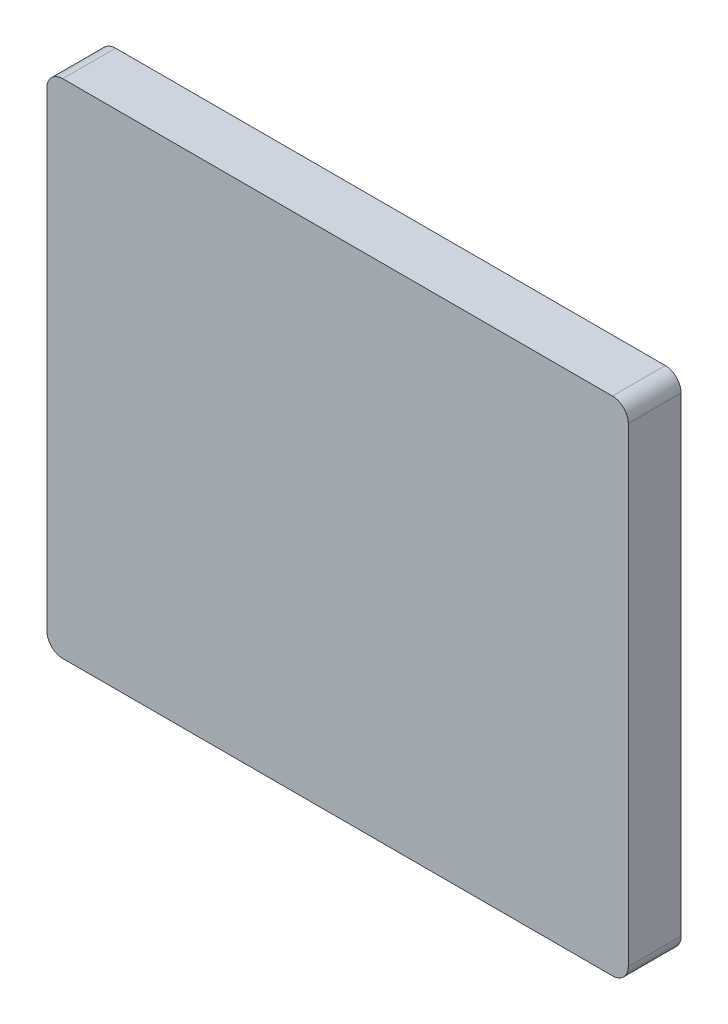
from build123d import *

# Parameters (mm, degrees)
SKETCH1_W           = 110
SKETCH1_H           = 95
BOSS_EXTRUDE2_DEPTH = 10
FILLET1_R           = 3


with BuildPart() as part:
    # Sketch1 → Boss-Extrude2 (new body)
    with BuildSketch(Plane.XY):
        with Locations((-22.518159806, -0.115012107)):
            Rectangle(SKETCH1_W, SKETCH1_H)
    extrude(amount=-BOSS_EXTRUDE2_DEPTH)

    # Fillet1
    fillet1_edges = [part.edges().sort_by_distance(p)[0] for p in [
        (-77.518159806, 47.384987893, -5),
        (32.481840194, 47.384987893, -5),
        (32.481840194, -47.615012107, -5),
        (-77.518159806, -47.615012107, -5),
    ]]
    fillet(fillet1_edges, radius=FILLET1_R)


solid = part.part
